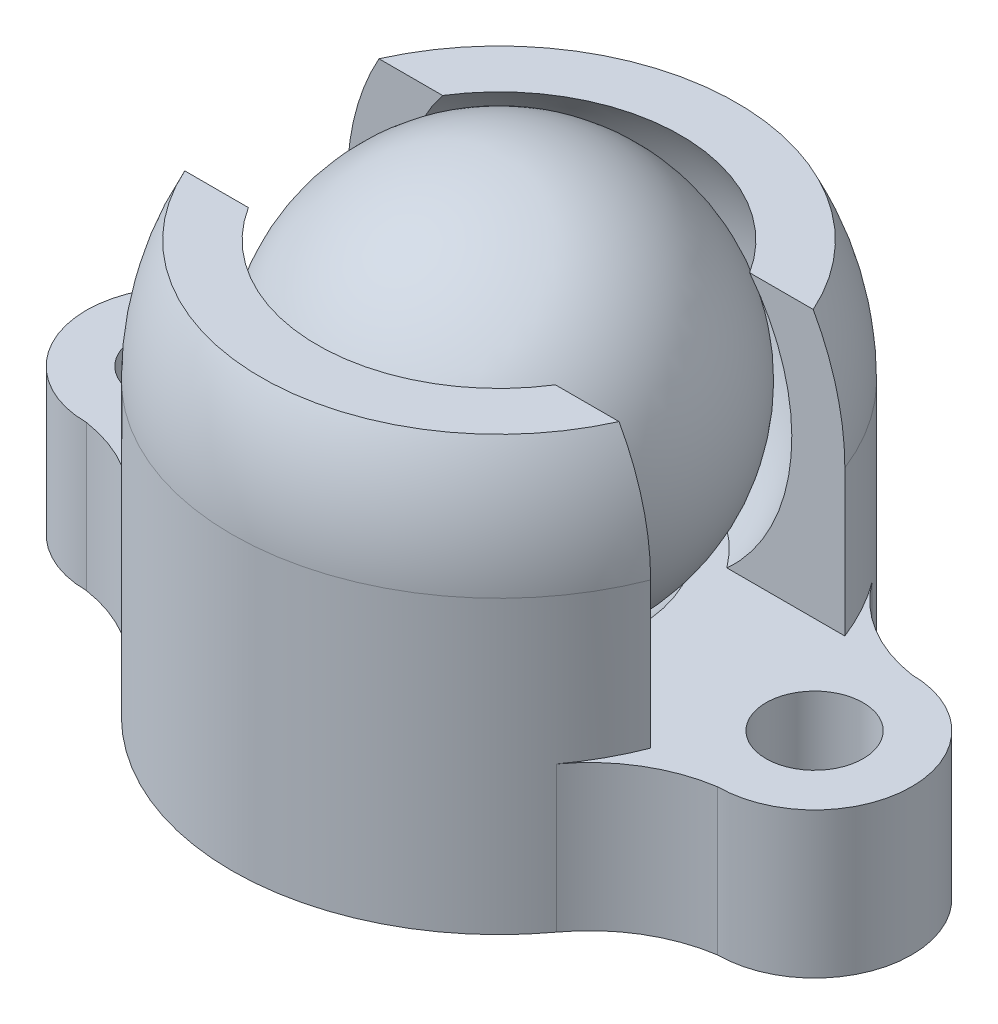
from build123d import *

# Parameters (mm, degrees)
SKETCH1_R               = 1
BOSS_EXTRUDE1_DEPTH     = 3
CUT_EXTRUDE2_DEPTH      = 14.219304066
CUT_EXTRUDE2_DEPTH_BACK = 14.219304066
SKETCH20_W              = 4
SKETCH20_H              = 5.5


with BuildPart() as part:
    # Sketch1 → Boss-Extrude1 (new body)
    with BuildSketch(Plane(origin=(0, 0, 0), x_dir=(1, 0, 0), z_dir=(0, 1, 0))):
        with BuildLine():
            ThreePointArc((-4.437059837, -3.25), (0, -5.5), (4.437059837, -3.25))
            ThreePointArc((4.437059837, -3.25), (5.343838437, -2.419215147), (6.5, -2))
            ThreePointArc((6.5, -2), (8.5, 0), (6.5, 2))
            ThreePointArc((6.5, 2), (5.343838437, 2.419215147), (4.437059837, 3.25))
            ThreePointArc((4.437059837, 3.25), (0, 5.5), (-4.437059837, 3.25))
            ThreePointArc((-4.437059837, 3.25), (-5.343838437, 2.419215147), (-6.5, 2))
            ThreePointArc((-6.5, 2), (-8.5, 0), (-6.5, -2))
            ThreePointArc((-6.5, -2), (-5.343838437, -2.419215147), (-4.437059837, -3.25))
        make_face()
        with Locations(Location((-6.5, 0, 0), (0, 0, 270))):
            Circle(SKETCH1_R, mode=Mode.SUBTRACT)
        with Locations(Location((6.5, 0, 0), (0, 0, 270))):
            Circle(SKETCH1_R, mode=Mode.SUBTRACT)
    extrude(amount=BOSS_EXTRUDE1_DEPTH)

    # Sketch10 → Cut-Revolve2 (revolve, cut)
    with BuildSketch(Plane.XY):
        with BuildLine():
            Line((0, 2), (0, 11))
            ThreePointArc((0, 11), (4.5, 6.5), (0, 2))
        make_face()
    revolve(axis=Axis((0, 2, 0), (0, 1, 0)), mode=Mode.SUBTRACT)

    # Sketch19 → Revolve6 (revolve)
    with BuildSketch(Plane(origin=(0, 0, 0), x_dir=(0, 0, -1), z_dir=(1, 0, 0)), mode=Mode.PRIVATE) as revolve6_sk:
        with BuildLine():
            Line((5.5, 6), (5.5, 3))
            Line((5.5, 3), (3.354101966, 3))
            ThreePointArc((3.354101966, 3), (4.48886959, 5.683693501), (3.741657387, 8.5))
            Line((3.741657387, 8.5), (4.898979486, 8.5))
            ThreePointArc((4.898979486, 8.5), (5.347634392, 7.285615189), (5.5, 6))
        make_face()
    revolve(revolve6_sk.sketch.rotate(Axis((0, 10, 0), (0, -1, 0)), 270), axis=Axis((0, 10, 0), (0, -1, 0)))

    # Sketch20 → Cut-Extrude2 (cut, two sides: drawn at the far end of the back side and taken through both)
    with BuildSketch(Plane(origin=(0, 0, 0), x_dir=(0, 0, -1), z_dir=(1, 0, 0)).offset(-CUT_EXTRUDE2_DEPTH_BACK)):
        with Locations((0, 5.75)):
            Rectangle(SKETCH20_W, SKETCH20_H)
    extrude(amount=CUT_EXTRUDE2_DEPTH + CUT_EXTRUDE2_DEPTH_BACK, mode=Mode.SUBTRACT)


with BuildPart() as body_2:
    # Sketch18 → Revolve7 (revolve)
    with BuildSketch(Plane(origin=(0, 0, 0), x_dir=(0, 0, -1), z_dir=(1, 0, 0))):
        with BuildLine():
            Line((0, 10), (0, 2))
            ThreePointArc((0, 2), (4, 6), (0, 10))
        make_face()
    revolve(axis=Axis((0, 10, 0), (0, -1, 0)))


solid = Compound([part.part, body_2.part])
